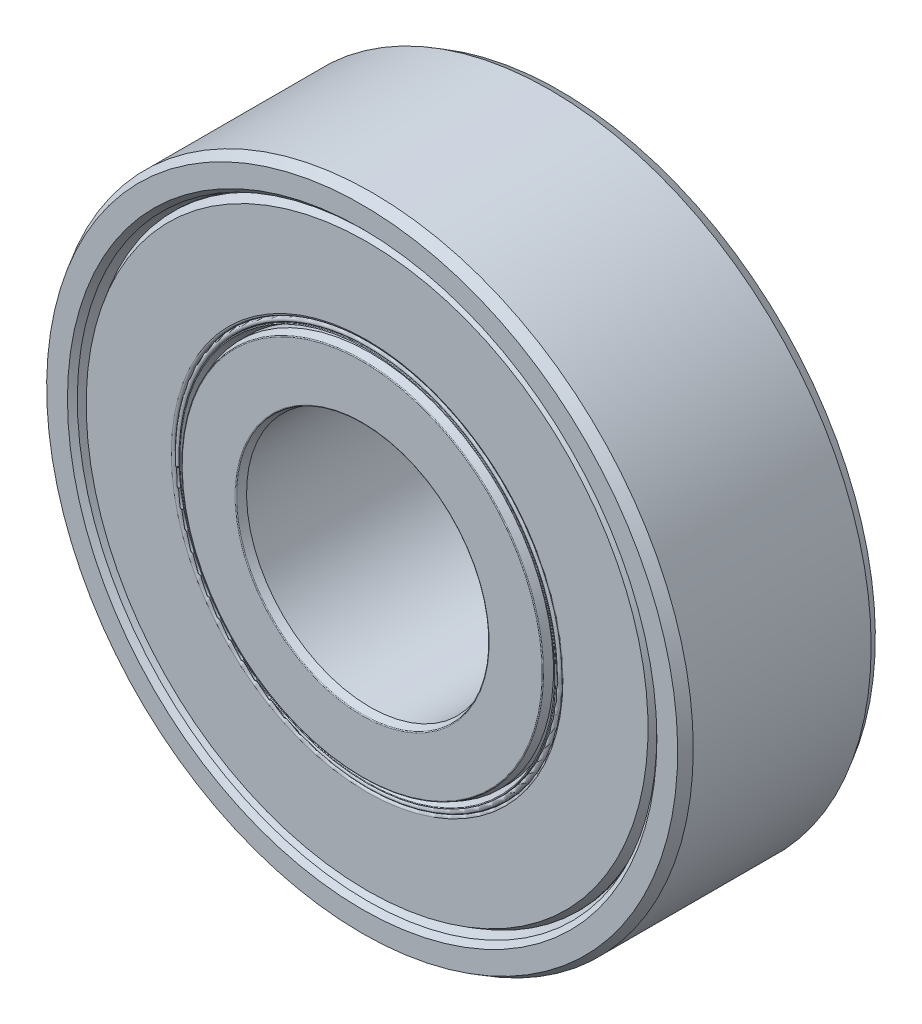
from build123d import *

# Parameters (mm, degrees)
CIRPATTERN1_COUNT = 10


with BuildPart() as part:
    # Sketch3 → Revolve1 (revolve)
    with BuildSketch(Plane(origin=(0, 0, 0), x_dir=(0, 0, -1), z_dir=(1, 0, 0)), mode=Mode.PRIVATE) as revolve1_sk:
        with BuildLine():
            Line((-3.36597457, 11.57), (-3.8, 11.727972337))
            Line((-3.8, 11.727972337), (-4, 11.927972337))
            Line((-4, 11.927972337), (-4, 12.769059892))
            Line((-4, 12.769059892), (-3.6, 13))
            Line((-3.6, 13), (3.6, 13))
            Line((3.6, 13), (4, 12.769059892))
            Line((4, 12.769059892), (4, 11.927972337))
            Line((4, 11.927972337), (3.8, 11.727972337))
            Line((3.8, 11.727972337), (3.36597457, 11.57))
            Line((3.36597457, 11.57), (1.864, 11.57))
            ThreePointArc((1.864, 11.57), (0, 12.285), (-1.864, 11.57))
            Line((-1.864, 11.57), (-3.36597457, 11.57))
        make_face()
    revolve(revolve1_sk.sketch.rotate(Axis((0, 0, 4), (0, 0, -1)), 180), axis=Axis((0, 0, 4), (0, 0, -1)))


with BuildPart() as body_2:
    # Sketch4 → Revolve2 (revolve)
    with BuildSketch(Plane(origin=(0, 0, 0), x_dir=(0, 0, -1), z_dir=(1, 0, 0)), mode=Mode.PRIVATE) as revolve2_sk:
        with BuildLine():
            Line((-3.68, 5), (-3.973680806, 5.106891072))
            ThreePointArc((-3.973680806, 5.106891072), (-3.992766082, 5.121535719), (-4, 5.144478776))
            Line((-4, 5.144478776), (-4, 7.281086258))
            ThreePointArc((-4, 7.281086258), (-3.992766082, 7.304029316), (-3.973680806, 7.318673963))
            Line((-3.973680806, 7.318673963), (-3.68, 7.425565035))
            Line((-3.68, 7.425565035), (-1.864, 7.425565035))
            ThreePointArc((-1.864, 7.425565035), (0, 6.710565035), (1.864, 7.425565035))
            Line((1.864, 7.425565035), (3.68, 7.425565035))
            Line((3.68, 7.425565035), (3.973680806, 7.318673963))
            ThreePointArc((3.973680806, 7.318673963), (3.992766082, 7.304029316), (4, 7.281086258))
            Line((4, 7.281086258), (4, 5.144478776))
            ThreePointArc((4, 5.144478776), (3.992766082, 5.121535719), (3.973680806, 5.106891072))
            Line((3.973680806, 5.106891072), (3.68, 5))
            Line((3.68, 5), (-3.68, 5))
        make_face()
    revolve(revolve2_sk.sketch.rotate(Axis((0, 0, 4), (0, 0, -1)), 180), axis=Axis((0, 0, 4), (0, 0, -1)))


with BuildPart() as body_3:
    # Sketch5 → Revolve3 (revolve)
    with BuildSketch(Plane(origin=(0, 0, 0), x_dir=(0, 0, -1), z_dir=(1, 0, 0))):
        with BuildLine():
            Line((-2.787217483, 9.497782517), (2.787217483, 9.497782517))
            ThreePointArc((2.787217483, 9.497782517), (0, 12.285), (-2.787217483, 9.497782517))
        make_face()
    revolve(axis=Axis((0, 9.497782517, 2.787217483), (0, 0, -1)))


with BuildPart() as cirpattern1_1:
    # CirPattern1: pattern copy
    add(body_3.part.rotate(Axis((0, 0, 0), (0, 0, 1)), 1 * 360 / CIRPATTERN1_COUNT))


with BuildPart() as cirpattern1_2:
    # CirPattern1: pattern copy
    add(body_3.part.rotate(Axis((0, 0, 0), (0, 0, 1)), 2 * 360 / CIRPATTERN1_COUNT))


with BuildPart() as cirpattern1_3:
    # CirPattern1: pattern copy
    add(body_3.part.rotate(Axis((0, 0, 0), (0, 0, 1)), 3 * 360 / CIRPATTERN1_COUNT))


with BuildPart() as cirpattern1_4:
    # CirPattern1: pattern copy
    add(body_3.part.rotate(Axis((0, 0, 0), (0, 0, 1)), 4 * 360 / CIRPATTERN1_COUNT))


with BuildPart() as cirpattern1_5:
    # CirPattern1: pattern copy
    add(body_3.part.rotate(Axis((0, 0, 0), (0, 0, 1)), 5 * 360 / CIRPATTERN1_COUNT))


with BuildPart() as cirpattern1_6:
    # CirPattern1: pattern copy
    add(body_3.part.rotate(Axis((0, 0, 0), (0, 0, 1)), 6 * 360 / CIRPATTERN1_COUNT))


with BuildPart() as cirpattern1_7:
    # CirPattern1: pattern copy
    add(body_3.part.rotate(Axis((0, 0, 0), (0, 0, 1)), 7 * 360 / CIRPATTERN1_COUNT))


with BuildPart() as cirpattern1_8:
    # CirPattern1: pattern copy
    add(body_3.part.rotate(Axis((0, 0, 0), (0, 0, 1)), 8 * 360 / CIRPATTERN1_COUNT))


with BuildPart() as cirpattern1_9:
    # CirPattern1: pattern copy
    add(body_3.part.rotate(Axis((0, 0, 0), (0, 0, 1)), 9 * 360 / CIRPATTERN1_COUNT))


with BuildPart() as body_13:
    # Sketch6 → Revolve4 (revolve)
    with BuildSketch(Plane(origin=(0, 0, 0), x_dir=(0, 0, -1), z_dir=(1, 0, 0)), mode=Mode.PRIVATE) as revolve4_sk:
        with BuildLine():
            Line((-3.453589838, 11.57), (-2.787217483, 11.57))
            Line((-2.787217483, 11.57), (-2.787217483, 7.825565035))
            Line((-2.787217483, 7.825565035), (-3.7, 7.825565035))
            ThreePointArc((-3.7, 7.825565035), (-3.770710678, 7.854854357), (-3.8, 7.925565035))
            Line((-3.8, 7.925565035), (-3.8, 11.37))
            Line((-3.8, 11.37), (-3.453589838, 11.57))
        make_face()
        with BuildLine():
            Line((3.7, 7.825565035), (2.787217483, 7.825565035))
            Line((2.787217483, 7.825565035), (2.787217483, 11.57))
            Line((2.787217483, 11.57), (3.453589838, 11.57))
            Line((3.453589838, 11.57), (3.8, 11.37))
            Line((3.8, 11.37), (3.8, 7.925565035))
            ThreePointArc((3.8, 7.925565035), (3.770710678, 7.854854357), (3.7, 7.825565035))
        make_face()
    revolve(revolve4_sk.sketch.rotate(Axis((0, 0, 4), (0, 0, -1)), 180), axis=Axis((0, 0, 4), (0, 0, -1)))


with BuildPart() as body_14:
    # Sketch7 → Revolve5 (revolve)
    with BuildSketch(Plane(origin=(0, 0, 0), x_dir=(0, 0, -1), z_dir=(1, 0, 0)), mode=Mode.PRIVATE) as revolve5_sk:
        with BuildLine():
            Line((-2.787217483, 7.425565035), (-3.343930153, 7.425565035))
            Line((-3.343930153, 7.425565035), (-3.786840403, 7.586771183))
            ThreePointArc((-3.786840403, 7.586771183), (-3.799696155, 7.609037999), (-3.78, 7.625565035))
            Line((-3.78, 7.625565035), (-3.7, 7.625565035))
            ThreePointArc((-3.7, 7.625565035), (-3.8, 7.725565035), (-3.7, 7.825565035))
            Line((-3.7, 7.825565035), (-2.787217483, 7.825565035))
            Line((-2.787217483, 7.825565035), (-2.787217483, 7.425565035))
        make_face()
        with BuildLine():
            Line((2.787217483, 7.825565035), (2.787217483, 7.425565035))
            Line((2.787217483, 7.425565035), (3.343930153, 7.425565035))
            Line((3.343930153, 7.425565035), (3.786840403, 7.586771183))
            ThreePointArc((3.786840403, 7.586771183), (3.799696155, 7.609037999), (3.78, 7.625565035))
            Line((3.78, 7.625565035), (3.7, 7.625565035))
            ThreePointArc((3.7, 7.625565035), (3.8, 7.725565035), (3.7, 7.825565035))
            Line((3.7, 7.825565035), (2.787217483, 7.825565035))
        make_face()
    revolve(revolve5_sk.sketch.rotate(Axis((0, 0, 4), (0, 0, -1)), 180), axis=Axis((0, 0, 4), (0, 0, -1)))


solid = Compound([part.part, body_2.part, body_3.part, cirpattern1_1.part, cirpattern1_2.part, cirpattern1_3.part, cirpattern1_4.part, cirpattern1_5.part, cirpattern1_6.part, cirpattern1_7.part, cirpattern1_8.part, cirpattern1_9.part, body_13.part, body_14.part])
